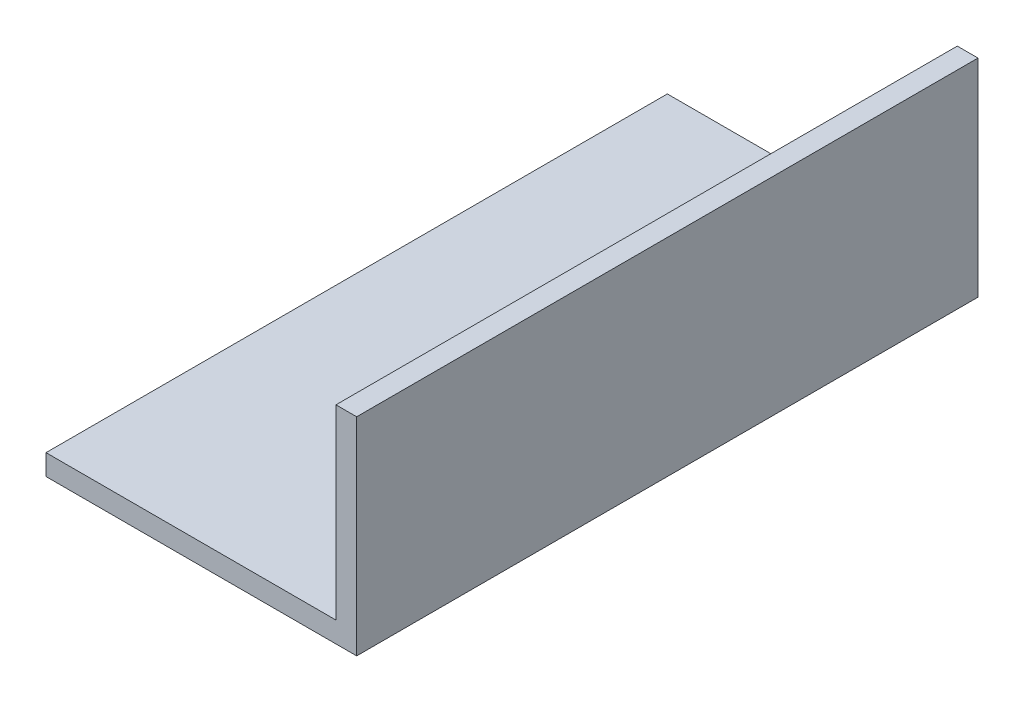
from build123d import *

# Parameters (mm, degrees)
BOSS_EXTRUDE2_DEPTH = 38.1


with BuildPart() as part:
    # Sketch1 → Boss-Extrude2 (new, symmetric)
    with BuildSketch(Plane.XY):
        Polygon((16.51, 12.7), (16.51, -10.16), (-19.05, -10.16), (-19.05, -12.7), (19.05, -12.7), (19.05, 12.7), align=None)
    extrude(amount=BOSS_EXTRUDE2_DEPTH, both=True)


solid = part.part
